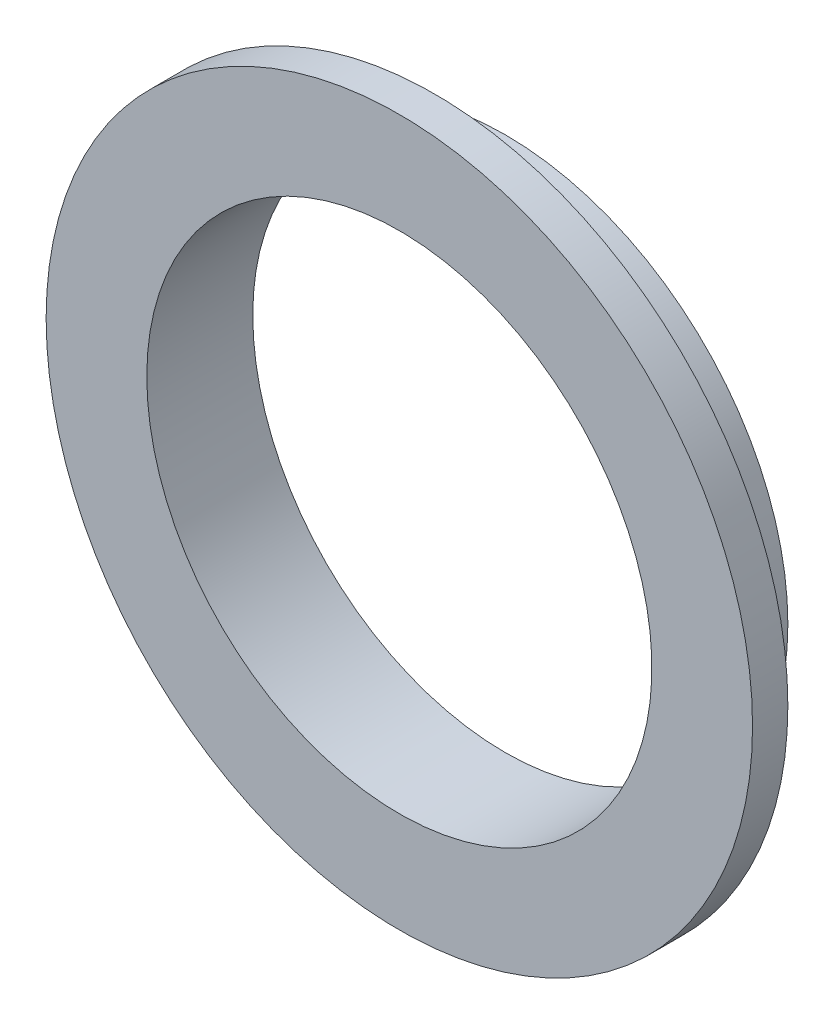
from build123d import *

# Parameters (mm, degrees)
SKETCH_1_R          = 16
SKETCH_1_R_2        = 14.3
EXTRUDE_1_DEPTH     = 4
SKETCH_2_R          = 20
EXTRUDE_2_DEPTH     = 2
SKETCH_3_R          = 14.3
CUT_EXTRUDE_1_DEPTH = 2


with BuildPart() as part:
    # 草图1 → 凸台-拉伸1 (new body)
    with BuildSketch(Plane.XY):
        Circle(SKETCH_1_R)
        Circle(SKETCH_1_R_2, mode=Mode.SUBTRACT)
    extrude(amount=EXTRUDE_1_DEPTH)

    # 草图2 → 凸台-拉伸2 (add)
    with BuildSketch(Plane.XY.offset(4)):
        Circle(SKETCH_2_R)
    extrude(amount=EXTRUDE_2_DEPTH)

    # 草图3 → 切除-拉伸1 (cut)
    with BuildSketch(Plane(origin=(0, 0, 4), x_dir=(-1, 0, 0), z_dir=(0, 0, -1))):
        Circle(SKETCH_3_R)
    extrude(amount=-CUT_EXTRUDE_1_DEPTH, mode=Mode.SUBTRACT)


solid = part.part
